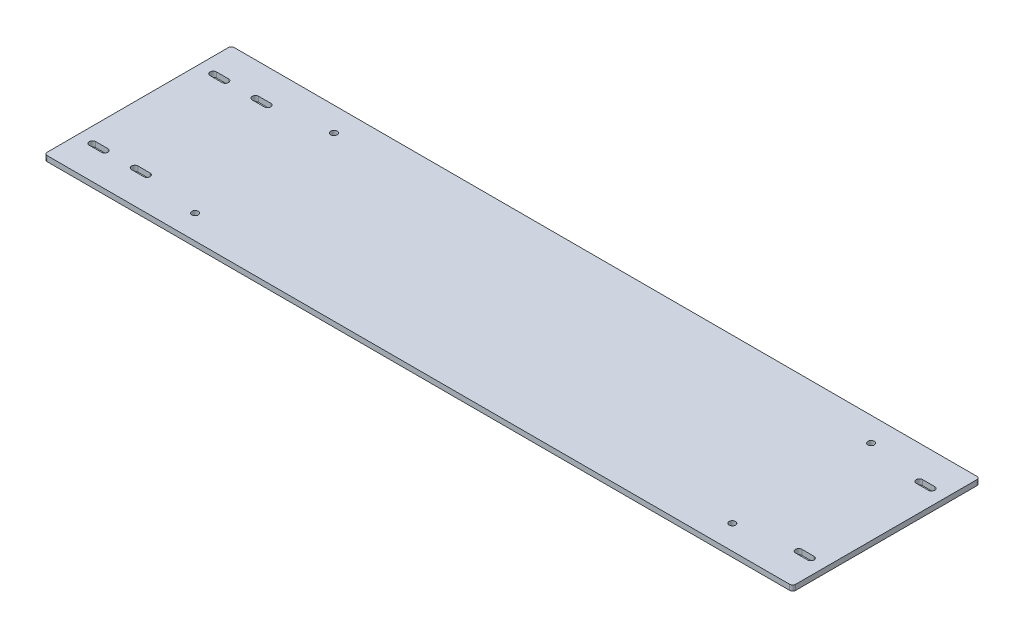
from build123d import *

# Parameters (mm, degrees)
SKETCH1_W           = 787.4
SKETCH1_H           = 196.85
BOSS_EXTRUDE1_DEPTH = 5.588
FILLET1_R           = 3.175
SKETCH2_R           = 3.3782
CUT_EXTRUDE1_DEPTH  = 812.652578536


with BuildPart() as part:
    # Sketch1 → Boss-Extrude1 (new body)
    with BuildSketch(Plane(origin=(0, 0, 0), x_dir=(1, 0, 0), z_dir=(0, 1, 0))):
        with Locations((393.7, 98.425)):
            Rectangle(SKETCH1_W, SKETCH1_H)
        with BuildLine():
            Line((15.875, 38.3032), (28.575, 38.3032))
            ThreePointArc((28.575, 38.3032), (31.9532, 34.925), (28.575, 31.5468))
            Line((28.575, 31.5468), (15.875, 31.5468))
            ThreePointArc((15.875, 31.5468), (12.4968, 34.925), (15.875, 38.3032))
        make_face(mode=Mode.SUBTRACT)
        with BuildLine():
            Line((15.875, 165.3032), (28.575, 165.3032))
            ThreePointArc((28.575, 165.3032), (31.9532, 161.925), (28.575, 158.5468))
            Line((28.575, 158.5468), (15.875, 158.5468))
            ThreePointArc((15.875, 158.5468), (12.4968, 161.925), (15.875, 165.3032))
        make_face(mode=Mode.SUBTRACT)
        with BuildLine():
            Line((60.325, 165.3032), (73.025, 165.3032))
            ThreePointArc((73.025, 165.3032), (76.4032, 161.925), (73.025, 158.5468))
            Line((73.025, 158.5468), (60.325, 158.5468))
            ThreePointArc((60.325, 158.5468), (56.9468, 161.925), (60.325, 165.3032))
        make_face(mode=Mode.SUBTRACT)
        with BuildLine():
            Line((60.325, 38.3032), (73.025, 38.3032))
            ThreePointArc((73.025, 38.3032), (76.4032, 34.925), (73.025, 31.5468))
            Line((73.025, 31.5468), (60.325, 31.5468))
            ThreePointArc((60.325, 31.5468), (56.9468, 34.925), (60.325, 38.3032))
        make_face(mode=Mode.SUBTRACT)
        with BuildLine():
            Line((771.525, 158.5468), (758.825, 158.5468))
            ThreePointArc((758.825, 158.5468), (755.4468, 161.925), (758.825, 165.3032))
            Line((758.825, 165.3032), (771.525, 165.3032))
            ThreePointArc((771.525, 165.3032), (774.9032, 161.925), (771.525, 158.5468))
        make_face(mode=Mode.SUBTRACT)
        with BuildLine():
            Line((771.525, 31.5468), (758.825, 31.5468))
            ThreePointArc((758.825, 31.5468), (755.4468, 34.925), (758.825, 38.3032))
            Line((758.825, 38.3032), (771.525, 38.3032))
            ThreePointArc((771.525, 38.3032), (774.9032, 34.925), (771.525, 31.5468))
        make_face(mode=Mode.SUBTRACT)
    extrude(amount=BOSS_EXTRUDE1_DEPTH)

    # Fillet1
    fillet1_edges = [part.edges().sort_by_distance(p)[0] for p in [
        (0, 2.794, -196.85),
        (787.4, 2.794, -196.85),
        (787.4, 2.794, 0),
        (0, 2.794, 0),
    ]]
    fillet(fillet1_edges, radius=FILLET1_R)

    # Sketch2 → Cut-Extrude1 (cut, through all)
    with BuildSketch(Plane(origin=(0, 5.588, 0), x_dir=(1, 0, 0), z_dir=(0, 1, 0))):
        with Locations(Location((133.35, 171.45, 0), (0, 0, 270))):
            Circle(SKETCH2_R)
        with Locations(Location((133.35, 25.4, 0), (0, 0, 270))):
            Circle(SKETCH2_R)
        with Locations(Location((698.5, 25.4, 0), (0, 0, 270))):
            Circle(SKETCH2_R)
        with Locations(Location((698.5, 171.45, 0), (0, 0, 270))):
            Circle(SKETCH2_R)
    extrude(amount=-CUT_EXTRUDE1_DEPTH, mode=Mode.SUBTRACT)


solid = part.part
